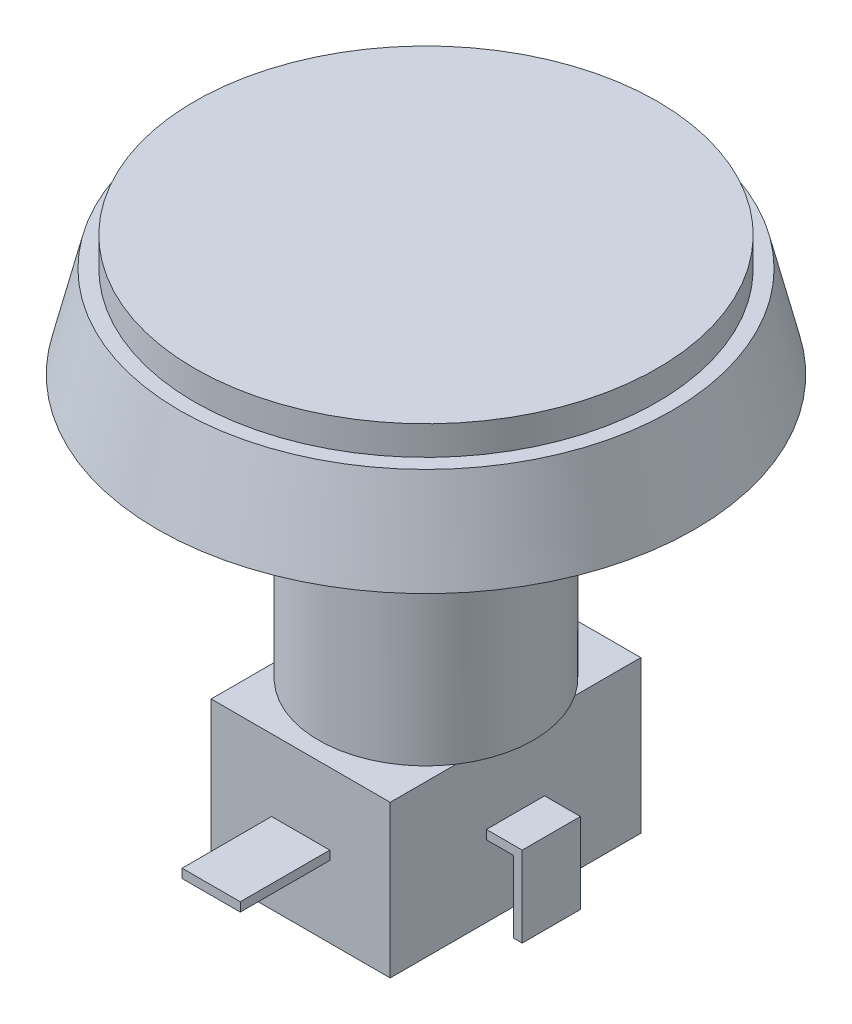
from build123d import *

# Parameters (mm, degrees)
SKETCH1_R             = 30
SKETCH2_R             = 27.5
SKETCH3_R             = 25.85
BUTTON_DEPTH          = 3.25
SKETCH4_R             = 12
THREAD_DEPTH          = 29.4
SKETCH5_R             = 1.675
ALIGNMENT_STUDS_DEPTH = 3.7
BOSS_EXTRUDE1_DEPTH   = 10
SKETCH6_3_W           = 10
SKETCH6_3_H           = 1
BOSS_EXTRUDE2_DEPTH   = 3.25
BOSS_EXTRUDE3_DEPTH   = 3.25


with BuildPart() as part:
    # Sketch1 → Frame section 0
    with BuildSketch(Plane(origin=(0, 0, 0), x_dir=(1, 0, 0), z_dir=(0, 1, 0))):
        Circle(SKETCH1_R)
    # Sketch2 → Frame section 1
    with BuildSketch(Plane(origin=(0, 10.25, 0), x_dir=(1, 0, 0), z_dir=(0, 1, 0))):
        Circle(SKETCH2_R)
    loft()

    # Sketch3 → Button (add)
    with BuildSketch(Plane(origin=(0, 10.25, 0), x_dir=(1, 0, 0), z_dir=(0, 1, 0))):
        Circle(SKETCH3_R)
    extrude(amount=BUTTON_DEPTH)

    # Sketch4 → Thread (add)
    with BuildSketch(Plane.XZ):
        Circle(SKETCH4_R)
    extrude(amount=THREAD_DEPTH)

    # Sketch5 → Alignment studs (add)
    with BuildSketch(Plane.XZ):
        with Locations((0, 18.75)):
            Circle(SKETCH5_R)
        with Locations((0, -18.75)):
            Circle(SKETCH5_R)
    extrude(amount=ALIGNMENT_STUDS_DEPTH)

    # Sketch6 → Boss-Extrude1 (add, symmetric)
    with BuildSketch(Plane(origin=(0, 0, 0), x_dir=(0, 0, -1), z_dir=(1, 0, 0))):
        Polygon((14, -46.4), (14, -29.4), (-14, -29.4), (-14, -37.4), (-14, -38.4), (-14, -46.4), (-0.5, -46.4), (0.5, -46.4), align=None)
    extrude(amount=BOSS_EXTRUDE1_DEPTH, both=True)

    # Sketch6<3> → Boss-Extrude2 (add, symmetric)
    with BuildSketch(Plane(origin=(0, 0, 0), x_dir=(0, 0, -1), z_dir=(1, 0, 0))):
        with Locations((-19, -37.9)):
            Rectangle(SKETCH6_3_W, SKETCH6_3_H)
        Polygon((0.5, -50.4), (0.5, -46.4), (-0.5, -46.4), (-0.5, -49.4), (-9, -49.4), (-9, -50.4), align=None)
    extrude(amount=BOSS_EXTRUDE2_DEPTH, both=True)

    # Sketch7 → Boss-Extrude3 (add, symmetric)
    with BuildSketch(Plane.XY):
        Polygon((-10, -37.4), (-14, -37.4), (-14, -46.4), (-13, -46.4), (-13, -38.4), (-10, -38.4), align=None)
        Polygon((10, -37.4), (10, -38.4), (13, -38.4), (13, -46.4), (14, -46.4), (14, -37.4), align=None)
    extrude(amount=BOSS_EXTRUDE3_DEPTH, both=True)


solid = part.part
